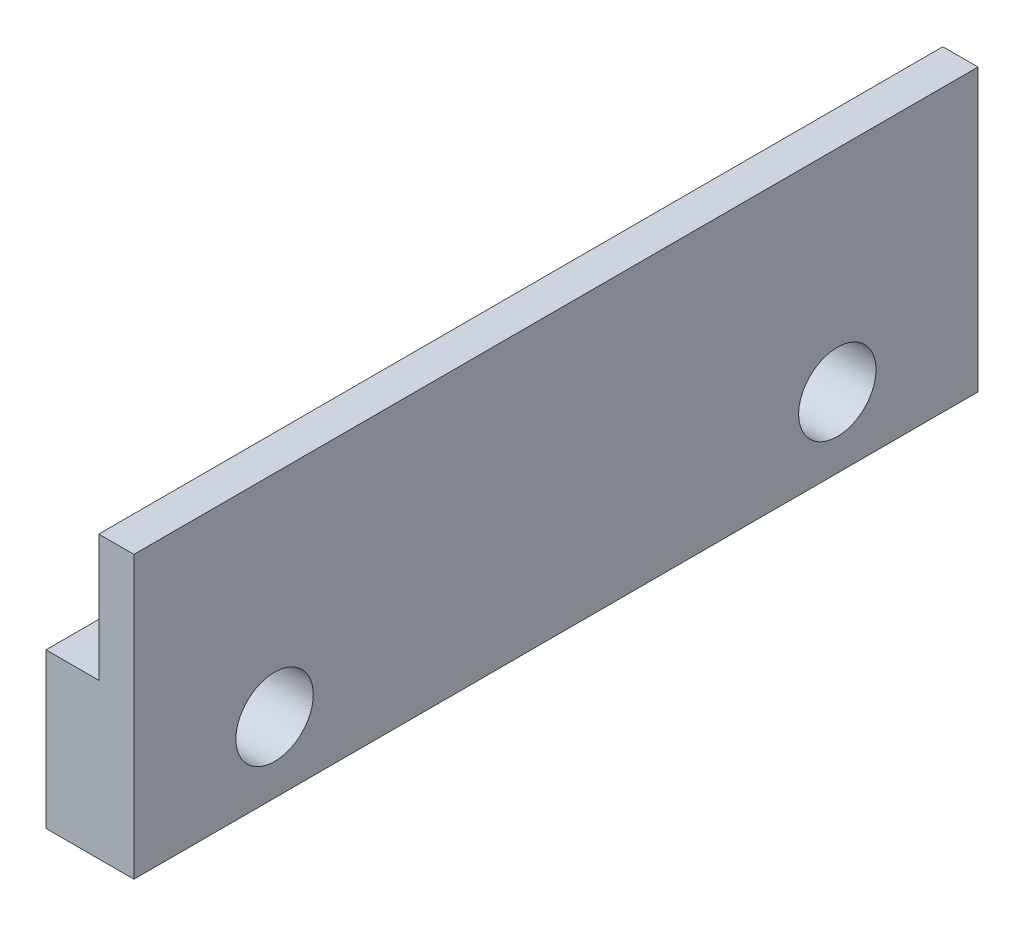
from build123d import *

# Parameters (mm, degrees)
BOSS_EXTRUDE1_DEPTH = 152.4
SKETCH2_R           = 6.985
CUT_EXTRUDE1_DEPTH  = 15.875


with BuildPart() as part:
    # Sketch1 → Boss-Extrude1 (new body)
    with BuildSketch(Plane.XY):
        Polygon((0, 17.2640625), (0, -5.5959375), (-9.525, -5.5959375), (-9.525, -33.5359375), (6.35, -33.5359375), (6.35, 17.2640625), align=None)
    extrude(amount=BOSS_EXTRUDE1_DEPTH)

    # Sketch2 → Cut-Extrude1 (cut)
    with BuildSketch(Plane(origin=(6.35, 0, 0), x_dir=(0, 0, -1), z_dir=(1, 0, 0))):
        with Locations(Location((-127, -20.8359375, 0), (0, 0, 90))):
            Circle(SKETCH2_R)
        with Locations(Location((-25.4, -20.8359375, 0), (0, 0, 270))):
            Circle(SKETCH2_R)
    extrude(amount=-CUT_EXTRUDE1_DEPTH, mode=Mode.SUBTRACT)


solid = part.part
